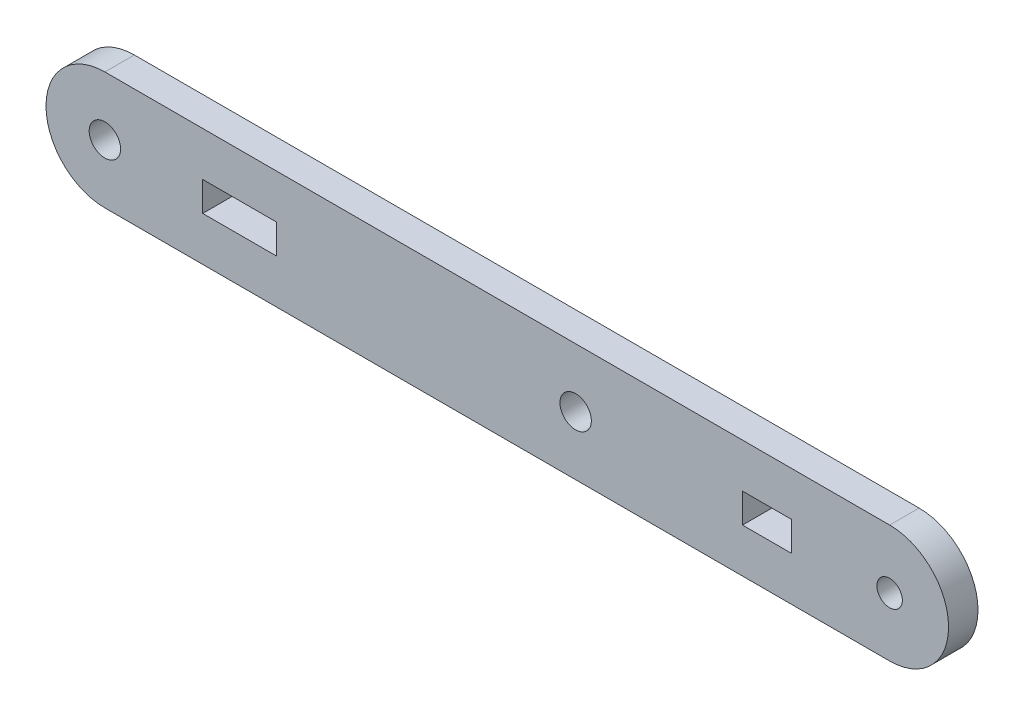
from build123d import *

# Parameters (mm, degrees)
SKETCH_1_R          = 1.3
SKETCH_1_W          = 7.4992
SKETCH_1_H          = 3.0001
SKETCH_1_W_2        = 4.9995
EXTRUDE_1_DEPTH     = 3
SKETCH_2_R          = 1.6
CUT_EXTRUDE_1_DEPTH = 57.708942736


with BuildPart() as part:
    # 草图1 → 凸台-拉伸1 (new body)
    with BuildSketch(Plane(origin=(0, 0, 0), x_dir=(-1, 0, 0), z_dir=(0, 0, -1))):
        with BuildLine():
            Line((-30.618171933, 0), (49.343510787, 0))
            ThreePointArc((49.343510787, 0), (55.343510787, 6), (49.343510787, 12))
            Line((49.343510787, 12), (-30.618171933, 12))
            ThreePointArc((-30.618171933, 12), (-36.618171933, 6), (-30.618171933, 0))
        make_face()
        with Locations(Location((49.343510787, 6, 0), (0, 0, 180))):
            Circle(SKETCH_1_R, mode=Mode.SUBTRACT)
        with Locations(Location((1.379286828, 6.00015, 0), (0, 0, 180))):
            Circle(SKETCH_1_R, mode=Mode.SUBTRACT)
        with Locations(Location((-30.611606698, 6.0001, 0), (0, 0, 180))):
            Circle(SKETCH_1_R, mode=Mode.SUBTRACT)
        with Locations((35.628693302, 5.99945)):
            Rectangle(SKETCH_1_W, SKETCH_1_H, mode=Mode.SUBTRACT)
        with Locations((-18.121556698, 5.99945)):
            Rectangle(SKETCH_1_W_2, SKETCH_1_H, mode=Mode.SUBTRACT)
    extrude(amount=-EXTRUDE_1_DEPTH)

    # 草图2 → 切除-拉伸1 (cut, through all)
    with BuildSketch(Plane.XY.offset(3)):
        with Locations((-49.343510787, 6)):
            Circle(SKETCH_2_R)
        with Locations((-1.379286828, 6.00015)):
            Circle(SKETCH_2_R)
    extrude(amount=-CUT_EXTRUDE_1_DEPTH, mode=Mode.SUBTRACT)


solid = part.part
